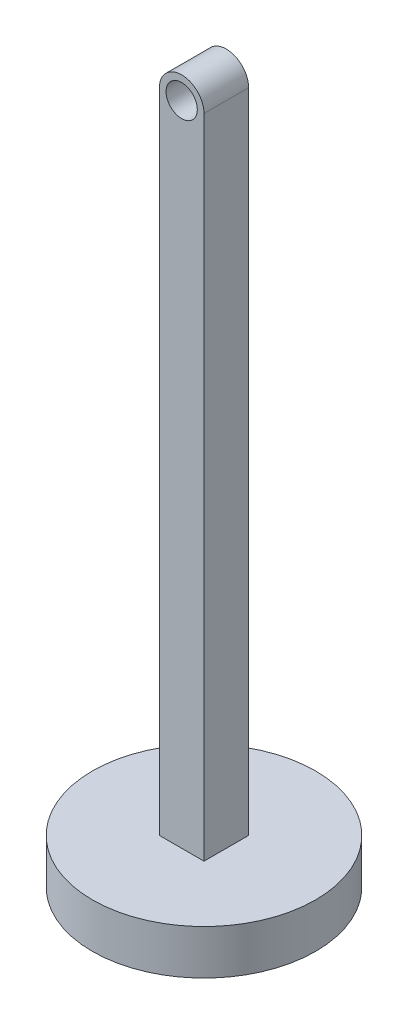
from build123d import *

# Parameters (mm, degrees)
SKETCH1_R           = 3.5
BOSS_EXTRUDE1_DEPTH = 10
SKETCH2_R           = 25
BOSS_EXTRUDE2_DEPTH = 5


with BuildPart() as part:
    # Sketch1 → Boss-Extrude1 (new body)
    with BuildSketch(Plane.XY):
        with BuildLine():
            Line((-5, 0), (-5, -150))
            Line((-5, -150), (5, -150))
            Line((5, -150), (5, 0))
            ThreePointArc((5, 0), (0, 5), (-5, 0))
        make_face()
        Circle(SKETCH1_R, mode=Mode.SUBTRACT)
    extrude(amount=BOSS_EXTRUDE1_DEPTH)

    # Sketch2 → Boss-Extrude2 (add, symmetric)
    with BuildSketch(Plane.XZ.offset(150)):
        with Locations(Location((0, 5, 0), (0, 0, 270))):
            Circle(SKETCH2_R)
    extrude(amount=BOSS_EXTRUDE2_DEPTH, both=True)


solid = part.part
